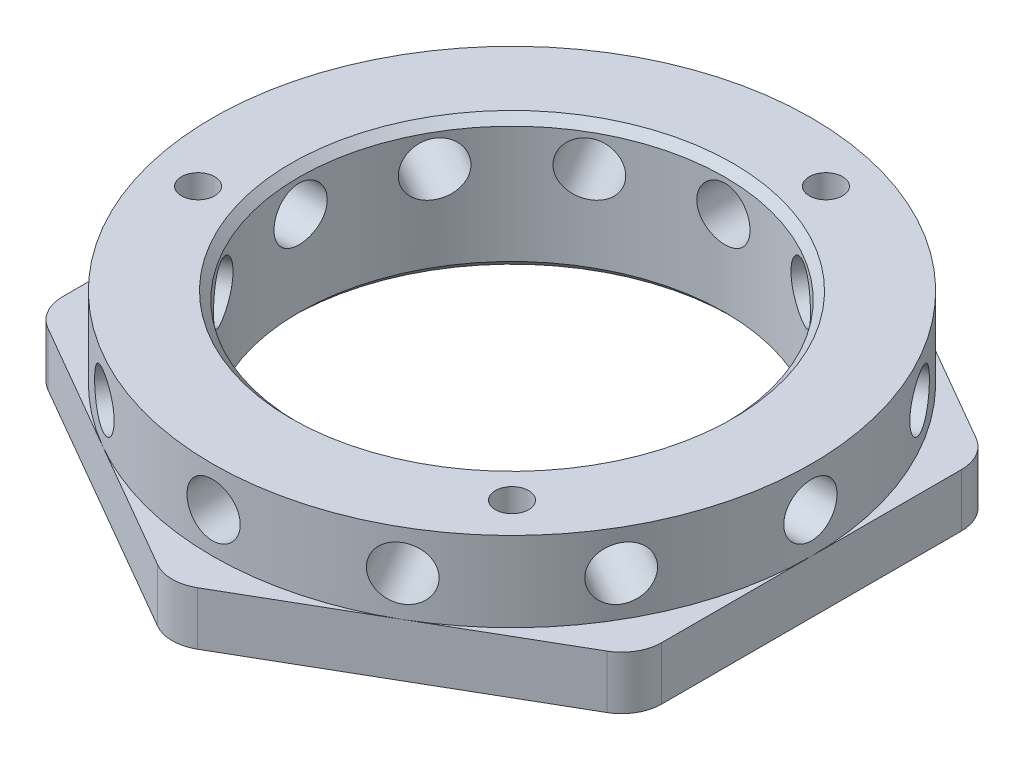
from build123d import *

# Parameters (mm, degrees)
SKETCH1_R                  = 22.5
SKETCH1_R_2                = 16
BOSS_EXTRUDE1_DEPTH        = 6
SKETCH2_R                  = 16
BOSS_EXTRUDE2_DEPTH        = 4
F_4_0MM_DOWEL_HOLE1_REACH  = 54.202
F_4_0MM_DOWEL_HOLE1_BORE_R = 2
CIRPATTERN1_COUNT          = 12
M3_TAPPED_HOLE2_D          = 2.5
CHAMFER1_SIZE              = 0.6


with BuildPart() as part:
    # Sketch1 → Boss-Extrude1 (new body)
    with BuildSketch(Plane(origin=(0, 0, 0), x_dir=(1, 0, 0), z_dir=(0, 1, 0))):
        with Locations(Location((0, 0, 0), (0, 0, 270))):
            Circle(SKETCH1_R)
        with Locations(Location((0, 0, 0), (0, 0, 270))):
            Circle(SKETCH1_R_2, mode=Mode.SUBTRACT)
    extrude(amount=-BOSS_EXTRUDE1_DEPTH)

    # Sketch2 → Boss-Extrude2 (add)
    with BuildSketch(Plane.XZ.offset(6)):
        with BuildLine():
            Line((22.5, -11.258330249), (22.5, 11.258330249))
            ThreePointArc((22.5, 11.258330249), (22.098076211, 12.758330249), (21, 13.856406461))
            Line((21, 13.856406461), (1.5, 25.11473671))
            ThreePointArc((1.5, 25.11473671), (0, 25.516660498), (-1.5, 25.11473671))
            Line((-1.5, 25.11473671), (-21, 13.856406461))
            ThreePointArc((-21, 13.856406461), (-22.098076211, 12.758330249), (-22.5, 11.258330249))
            Line((-22.5, 11.258330249), (-22.5, -11.258330249))
            ThreePointArc((-22.5, -11.258330249), (-22.098076211, -12.758330249), (-21, -13.856406461))
            Line((-21, -13.856406461), (-1.5, -25.11473671))
            ThreePointArc((-1.5, -25.11473671), (0, -25.516660498), (1.5, -25.11473671))
            Line((1.5, -25.11473671), (21, -13.856406461))
            ThreePointArc((21, -13.856406461), (22.098076211, -12.758330249), (22.5, -11.258330249))
        make_face()
        with Locations(Location((0, 0, 0), (0, 0, 90))):
            Circle(SKETCH2_R, mode=Mode.SUBTRACT)
    extrude(amount=BOSS_EXTRUDE2_DEPTH)

    # Ø4.0mm Dowel Hole1 bore (on position points) → Ø4.0mm Dowel Hole1 (cut, up to next)
    with BuildSketch(Plane(origin=(22.5, -3, 0), x_dir=(0, 0, 1), z_dir=(1, 0, 0)), mode=Mode.PRIVATE) as f_4_0mm_dowel_hole1_sk1:
        Circle(F_4_0MM_DOWEL_HOLE1_BORE_R)
    f_4_0mm_dowel_hole1_tool1 = extrude(f_4_0mm_dowel_hole1_sk1.sketch, amount=-F_4_0MM_DOWEL_HOLE1_REACH, mode=Mode.PRIVATE) & part.part
    f_4_0mm_dowel_hole1 = f_4_0mm_dowel_hole1_tool1.solids().sort_by_distance((22.5, -3, 0))[0]
    add(f_4_0mm_dowel_hole1, mode=Mode.SUBTRACT)

    # CirPattern1: Ø4.0mm Dowel Hole1 ×12 about axis
    cirpattern1_axis = Axis((0, -6, 0), (0, 1, 0))
    for i in range(1, CIRPATTERN1_COUNT):
        add(f_4_0mm_dowel_hole1.rotate(cirpattern1_axis, i * 360 / CIRPATTERN1_COUNT), mode=Mode.SUBTRACT)

    # M3 Tapped Hole2 (through all)
    with Locations(Plane(origin=(0, 0, 0), x_dir=(-1, 0, 0), z_dir=(0, 1, 0))):
        with Locations((-13.611805538, 13.611805538), (-4.982266618, -18.594072156), (18.594072156, 4.982266618)):
            Hole(M3_TAPPED_HOLE2_D / 2)

    # Chamfer1
    chamfer1_edges = [part.edges().sort_by_distance(p)[0] for p in [
        (0, -10, -16),
        (0, 0, -16),
    ]]
    chamfer(chamfer1_edges, length=CHAMFER1_SIZE)


solid = part.part
